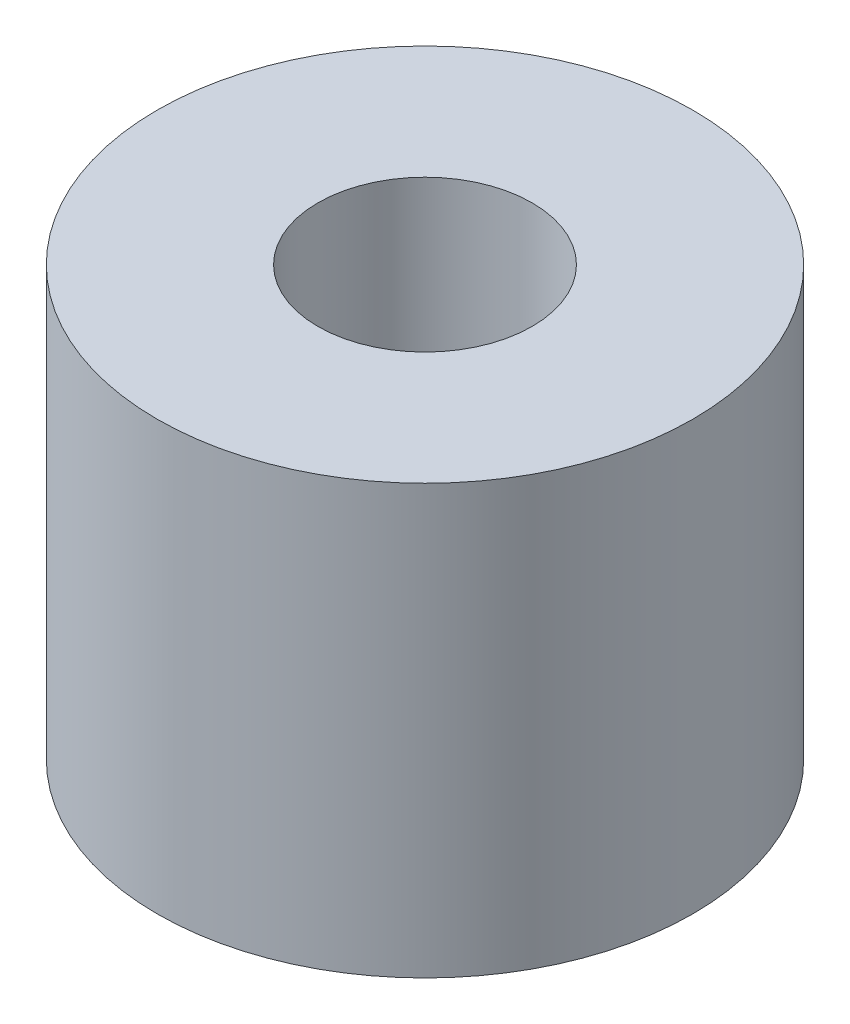
from build123d import *

# Parameters (mm, degrees)
IZIM1_R                     = 7.5
IZIM1_R_2                   = 3
Y_KSEKLIK_EKSTR_ZYON2_DEPTH = 12


with BuildPart() as part:
    # Çizim1 → Yükseklik-Ekstrüzyon2 (new body)
    with BuildSketch(Plane(origin=(0, 0, 0), x_dir=(1, 0, 0), z_dir=(0, 1, 0))):
        with Locations(Location((0, 0, 0), (0, 0, 270))):
            Circle(IZIM1_R)
        with Locations(Location((0, 0, 0), (0, 0, 270))):
            Circle(IZIM1_R_2, mode=Mode.SUBTRACT)
    extrude(amount=Y_KSEKLIK_EKSTR_ZYON2_DEPTH)


solid = part.part
